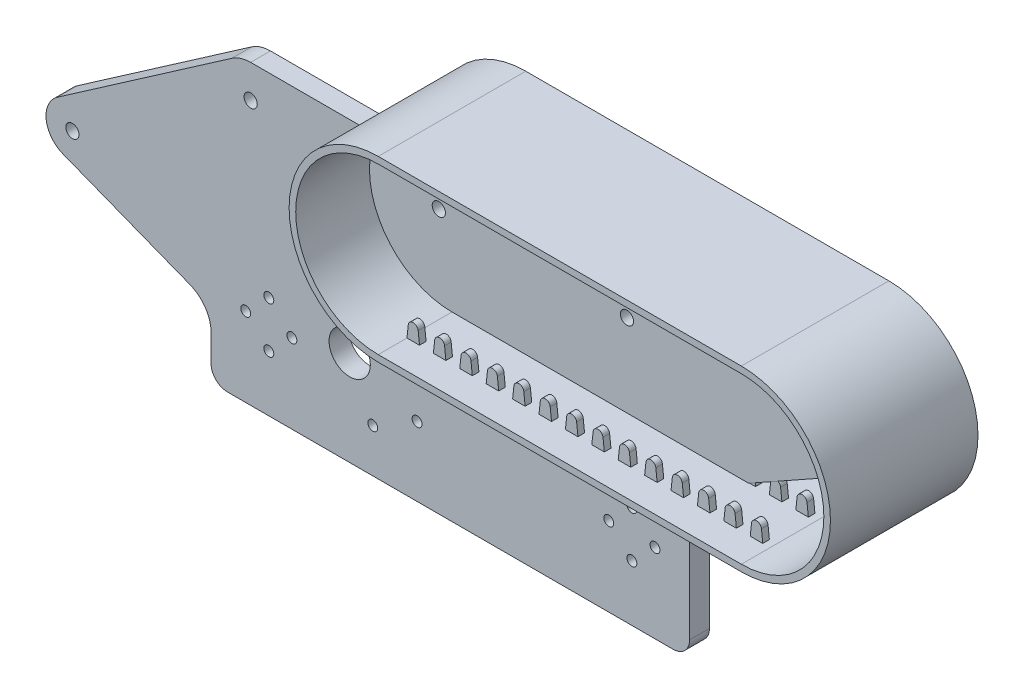
from build123d import *

# Parameters (mm, degrees)
SKETCH_1_R                        = 2
SKETCH_1_R_2                      = 6.25
SKETCH_1_R_3                      = 1.5
EXTRUDE_1_DEPTH                   = 6
SKETCH_2_R                        = 1.5
CUT_EXTRUDE_1_DEPTH               = 10
SKETCH_5_W                        = 44.7
SKETCH_5_H                        = 2
SKETCH_6_W                        = 3.8
SKETCH_6_H                        = 2
EXTRUDE_2_DEPTH                   = 10
CUT_EXTRUDE_2_DEPTH               = 19
PATTERN_LINEAR_2_COUNT            = 14
PATTERN_LINEAR_2_PITCH            = 8
PATTERN_LINEAR_2_COPY_1_SKETCH_W  = 3.8
PATTERN_LINEAR_2_COPY_1_SKETCH_H  = 2
PATTERN_LINEAR_2_COPY_1_DEPTH     = 10
PATTERN_LINEAR_2_COPY_2_SKETCH_W  = 3.8
PATTERN_LINEAR_2_COPY_2_SKETCH_H  = 2
PATTERN_LINEAR_2_COPY_2_DEPTH     = 10
PATTERN_LINEAR_2_COPY_3_SKETCH_W  = 3.8
PATTERN_LINEAR_2_COPY_3_SKETCH_H  = 2
PATTERN_LINEAR_2_COPY_3_DEPTH     = 10
PATTERN_LINEAR_2_COPY_4_SKETCH_W  = 3.8
PATTERN_LINEAR_2_COPY_4_SKETCH_H  = 2
PATTERN_LINEAR_2_COPY_4_DEPTH     = 10
PATTERN_LINEAR_2_COPY_5_SKETCH_W  = 3.8
PATTERN_LINEAR_2_COPY_5_SKETCH_H  = 2
PATTERN_LINEAR_2_COPY_5_DEPTH     = 10
PATTERN_LINEAR_2_COPY_6_SKETCH_W  = 3.8
PATTERN_LINEAR_2_COPY_6_SKETCH_H  = 2
PATTERN_LINEAR_2_COPY_6_DEPTH     = 10
PATTERN_LINEAR_2_COPY_7_SKETCH_W  = 3.8
PATTERN_LINEAR_2_COPY_7_SKETCH_H  = 2
PATTERN_LINEAR_2_COPY_7_DEPTH     = 10
PATTERN_LINEAR_2_COPY_8_SKETCH_W  = 3.8
PATTERN_LINEAR_2_COPY_8_SKETCH_H  = 2
PATTERN_LINEAR_2_COPY_8_DEPTH     = 10
PATTERN_LINEAR_2_COPY_9_SKETCH_W  = 3.8
PATTERN_LINEAR_2_COPY_9_SKETCH_H  = 2
PATTERN_LINEAR_2_COPY_9_DEPTH     = 10
PATTERN_LINEAR_2_COPY_10_SKETCH_W = 3.8
PATTERN_LINEAR_2_COPY_10_SKETCH_H = 2
PATTERN_LINEAR_2_COPY_10_DEPTH    = 10
PATTERN_LINEAR_2_COPY_11_SKETCH_W = 3.8
PATTERN_LINEAR_2_COPY_11_SKETCH_H = 2
PATTERN_LINEAR_2_COPY_11_DEPTH    = 10
PATTERN_LINEAR_2_COPY_12_SKETCH_W = 3.8
PATTERN_LINEAR_2_COPY_12_SKETCH_H = 2
PATTERN_LINEAR_2_COPY_12_DEPTH    = 10
PATTERN_LINEAR_2_COPY_13_SKETCH_W = 3.8
PATTERN_LINEAR_2_COPY_13_SKETCH_H = 2
PATTERN_LINEAR_2_COPY_13_DEPTH    = 10
PATTERN_LINEAR_2_COPY_14_DEPTH    = 19
PATTERN_LINEAR_2_COPY_15_DEPTH    = 19
PATTERN_LINEAR_2_COPY_16_DEPTH    = 19
PATTERN_LINEAR_2_COPY_17_DEPTH    = 19
PATTERN_LINEAR_2_COPY_18_DEPTH    = 19
PATTERN_LINEAR_2_COPY_19_DEPTH    = 19
PATTERN_LINEAR_2_COPY_20_DEPTH    = 19
PATTERN_LINEAR_2_COPY_21_DEPTH    = 19
PATTERN_LINEAR_2_COPY_22_DEPTH    = 19
PATTERN_LINEAR_2_COPY_23_DEPTH    = 19
PATTERN_LINEAR_2_COPY_24_DEPTH    = 19
PATTERN_LINEAR_2_COPY_25_DEPTH    = 19
PATTERN_LINEAR_2_COPY_26_DEPTH    = 19


with BuildPart() as part:
    # 草图1 → 凸台-拉伸1 (new body)
    with BuildSketch(Plane.XY):
        with BuildLine():
            Line((0, 5), (0, 13.171101822))
            ThreePointArc((0, 13.171101822), (-1.741847838, 18.810509847), (-6.360584575, 22.485319737))
            Line((-6.360584575, 22.485319737), (-44.91153234, 37.548625668))
            ThreePointArc((-44.91153234, 37.548625668), (-49.945464669, 44.067481265), (-46.557706877, 51.574747753))
            Line((-46.557706877, 51.574747753), (6.302866403, 88.218434692))
            ThreePointArc((6.302866403, 88.218434692), (9.015401779, 89.544221993), (12, 90))
            Line((12, 90), (187, 90))
            ThreePointArc((187, 90), (196.675632202, 82.526290066), (191.888690703, 71.2764283))
            Line((191.888690703, 71.2764283), (150.111309297, 47.864378387))
            ThreePointArc((150.111309297, 47.864378387), (146.371938021, 44.196154992), (145, 39.140806687))
            Line((145, 39.140806687), (145, 5))
            ThreePointArc((145, 5), (143.535533906, 1.464466094), (140, 0))
            Line((140, 0), (5, 0))
            ThreePointArc((5, 0), (1.464466094, 1.464466094), (0, 5))
        make_face()
        with Locations((-42, 45)):
            Circle(SKETCH_1_R, mode=Mode.SUBTRACT)
        with Locations((12, 80)):
            Circle(SKETCH_1_R, mode=Mode.SUBTRACT)
        with Locations((69, 80)):
            Circle(SKETCH_1_R, mode=Mode.SUBTRACT)
        with Locations((126, 80)):
            Circle(SKETCH_1_R, mode=Mode.SUBTRACT)
        with Locations((42, 28.75)):
            Circle(SKETCH_1_R_2, mode=Mode.SUBTRACT)
        with Locations((49, 44.25)):
            Circle(SKETCH_1_R_3, mode=Mode.SUBTRACT)
        with Locations((49, 13.25)):
            Circle(SKETCH_1_R_3, mode=Mode.SUBTRACT)
        with Locations((62.423393759, 21)):
            Circle(SKETCH_1_R_3, mode=Mode.SUBTRACT)
        with Locations((62.423393759, 36.5)):
            Circle(SKETCH_1_R_3, mode=Mode.SUBTRACT)
        with BuildLine():
            Line((183, 82), (187, 82))
            ThreePointArc((187, 82), (189, 80), (187, 78))
            Line((187, 78), (183, 78))
            ThreePointArc((183, 78), (181, 80), (183, 82))
        make_face(mode=Mode.SUBTRACT)
    extrude(amount=EXTRUDE_1_DEPTH)

    # 草图2 → 切除-拉伸1 (cut)
    with BuildSketch(Plane(origin=(0, 0, 0), x_dir=(-1, 0, 0), z_dir=(0, 0, -1))):
        with Locations((-17.5, 17)):
            Circle(SKETCH_2_R)
        with Locations((-24.5, 24)):
            Circle(SKETCH_2_R)
        with Locations((-17.5, 31)):
            Circle(SKETCH_2_R)
        with Locations((-10.5, 24)):
            Circle(SKETCH_2_R)
        with Locations((-127.5, 17)):
            Circle(SKETCH_2_R)
        with Locations((-134.5, 24)):
            Circle(SKETCH_2_R)
        with Locations((-127.5, 31)):
            Circle(SKETCH_2_R)
        with Locations((-120.5, 24)):
            Circle(SKETCH_2_R)
    extrude(amount=-CUT_EXTRUDE_1_DEPTH, mode=Mode.SUBTRACT)


with BuildPart() as body_2:
    # 扫描1: sweep along a path in 草图3
    with BuildLine(Plane.XY.offset(6)) as sweep_1_path:
        Line((73, 54), (183, 54))
        ThreePointArc((183, 54), (209, 80), (183, 106))
        Line((183, 106), (73, 106))
        ThreePointArc((73, 106), (47, 80), (73, 54))
    # 草图5 → 扫描1 (sweep)
    with BuildSketch(Plane(origin=(73, 54, 6), x_dir=(0, 0, -1), z_dir=(1, 0, 0))):
        Rectangle(SKETCH_5_W, SKETCH_5_H)
    sweep(path=sweep_1_path.line)

    # 草图6 → 凸台-拉伸2 (add)
    with BuildSketch(Plane(origin=(0, 55, 0), x_dir=(1, 0, 0), z_dir=(0, 1, 0))):
        with Locations((74.9, -4.85)):
            Rectangle(SKETCH_6_W, SKETCH_6_H)
        with Locations((74.9, -18.65)):
            Rectangle(SKETCH_6_W, SKETCH_6_H)
    extrude_2 = extrude(amount=EXTRUDE_2_DEPTH)

    # 草图7 → 切除-拉伸2 (cut)
    with BuildSketch(Plane.XY.offset(19.65)):
        with BuildLine():
            Line((73.4, 58.65519493), (73, 55))
            Line((73, 55), (73, 65))
            Line((73, 65), (76.8, 65))
            Line((76.8, 65), (76.8, 55))
            Line((76.8, 55), (76.4, 58.65519493))
            ThreePointArc((76.4, 58.65519493), (74.9, 60), (73.4, 58.65519493))
        make_face()
    cut_extrude_2 = extrude(amount=-CUT_EXTRUDE_2_DEPTH, mode=Mode.SUBTRACT)

    # 镜向1: 凸台-拉伸2, 切除-拉伸2 across plane
    add(extrude_2.mirror(Plane.ZX.offset(80)))
    add(cut_extrude_2.mirror(Plane.ZX.offset(80)), mode=Mode.SUBTRACT)

    # 阵列(线性)2: 凸台-拉伸2, 切除-拉伸2 ×14
    with Locations(*[(i * PATTERN_LINEAR_2_PITCH, 0, 0) for i in range(1, PATTERN_LINEAR_2_COUNT)]):
        add(extrude_2)
        add(cut_extrude_2, mode=Mode.SUBTRACT)

    # 阵列(线性)2 copy 1 sketch → 阵列(线性)2 copy 1 (add)
    with BuildSketch(Plane(origin=(8, 105, 0), x_dir=(1, 0, 0), z_dir=(0, -1, 0))):
        with Locations((74.9, 4.85)):
            Rectangle(PATTERN_LINEAR_2_COPY_1_SKETCH_W, PATTERN_LINEAR_2_COPY_1_SKETCH_H)
        with Locations((74.9, 18.65)):
            Rectangle(PATTERN_LINEAR_2_COPY_1_SKETCH_W, PATTERN_LINEAR_2_COPY_1_SKETCH_H)
    extrude(amount=PATTERN_LINEAR_2_COPY_1_DEPTH)

    # 阵列(线性)2 copy 2 sketch → 阵列(线性)2 copy 2 (add)
    with BuildSketch(Plane(origin=(16, 105, 0), x_dir=(1, 0, 0), z_dir=(0, -1, 0))):
        with Locations((74.9, 4.85)):
            Rectangle(PATTERN_LINEAR_2_COPY_2_SKETCH_W, PATTERN_LINEAR_2_COPY_2_SKETCH_H)
        with Locations((74.9, 18.65)):
            Rectangle(PATTERN_LINEAR_2_COPY_2_SKETCH_W, PATTERN_LINEAR_2_COPY_2_SKETCH_H)
    extrude(amount=PATTERN_LINEAR_2_COPY_2_DEPTH)

    # 阵列(线性)2 copy 3 sketch → 阵列(线性)2 copy 3 (add)
    with BuildSketch(Plane(origin=(24, 105, 0), x_dir=(1, 0, 0), z_dir=(0, -1, 0))):
        with Locations((74.9, 4.85)):
            Rectangle(PATTERN_LINEAR_2_COPY_3_SKETCH_W, PATTERN_LINEAR_2_COPY_3_SKETCH_H)
        with Locations((74.9, 18.65)):
            Rectangle(PATTERN_LINEAR_2_COPY_3_SKETCH_W, PATTERN_LINEAR_2_COPY_3_SKETCH_H)
    extrude(amount=PATTERN_LINEAR_2_COPY_3_DEPTH)

    # 阵列(线性)2 copy 4 sketch → 阵列(线性)2 copy 4 (add)
    with BuildSketch(Plane(origin=(32, 105, 0), x_dir=(1, 0, 0), z_dir=(0, -1, 0))):
        with Locations((74.9, 4.85)):
            Rectangle(PATTERN_LINEAR_2_COPY_4_SKETCH_W, PATTERN_LINEAR_2_COPY_4_SKETCH_H)
        with Locations((74.9, 18.65)):
            Rectangle(PATTERN_LINEAR_2_COPY_4_SKETCH_W, PATTERN_LINEAR_2_COPY_4_SKETCH_H)
    extrude(amount=PATTERN_LINEAR_2_COPY_4_DEPTH)

    # 阵列(线性)2 copy 5 sketch → 阵列(线性)2 copy 5 (add)
    with BuildSketch(Plane(origin=(40, 105, 0), x_dir=(1, 0, 0), z_dir=(0, -1, 0))):
        with Locations((74.9, 4.85)):
            Rectangle(PATTERN_LINEAR_2_COPY_5_SKETCH_W, PATTERN_LINEAR_2_COPY_5_SKETCH_H)
        with Locations((74.9, 18.65)):
            Rectangle(PATTERN_LINEAR_2_COPY_5_SKETCH_W, PATTERN_LINEAR_2_COPY_5_SKETCH_H)
    extrude(amount=PATTERN_LINEAR_2_COPY_5_DEPTH)

    # 阵列(线性)2 copy 6 sketch → 阵列(线性)2 copy 6 (add)
    with BuildSketch(Plane(origin=(48, 105, 0), x_dir=(1, 0, 0), z_dir=(0, -1, 0))):
        with Locations((74.9, 4.85)):
            Rectangle(PATTERN_LINEAR_2_COPY_6_SKETCH_W, PATTERN_LINEAR_2_COPY_6_SKETCH_H)
        with Locations((74.9, 18.65)):
            Rectangle(PATTERN_LINEAR_2_COPY_6_SKETCH_W, PATTERN_LINEAR_2_COPY_6_SKETCH_H)
    extrude(amount=PATTERN_LINEAR_2_COPY_6_DEPTH)

    # 阵列(线性)2 copy 7 sketch → 阵列(线性)2 copy 7 (add)
    with BuildSketch(Plane(origin=(56, 105, 0), x_dir=(1, 0, 0), z_dir=(0, -1, 0))):
        with Locations((74.9, 4.85)):
            Rectangle(PATTERN_LINEAR_2_COPY_7_SKETCH_W, PATTERN_LINEAR_2_COPY_7_SKETCH_H)
        with Locations((74.9, 18.65)):
            Rectangle(PATTERN_LINEAR_2_COPY_7_SKETCH_W, PATTERN_LINEAR_2_COPY_7_SKETCH_H)
    extrude(amount=PATTERN_LINEAR_2_COPY_7_DEPTH)

    # 阵列(线性)2 copy 8 sketch → 阵列(线性)2 copy 8 (add)
    with BuildSketch(Plane(origin=(64, 105, 0), x_dir=(1, 0, 0), z_dir=(0, -1, 0))):
        with Locations((74.9, 4.85)):
            Rectangle(PATTERN_LINEAR_2_COPY_8_SKETCH_W, PATTERN_LINEAR_2_COPY_8_SKETCH_H)
        with Locations((74.9, 18.65)):
            Rectangle(PATTERN_LINEAR_2_COPY_8_SKETCH_W, PATTERN_LINEAR_2_COPY_8_SKETCH_H)
    extrude(amount=PATTERN_LINEAR_2_COPY_8_DEPTH)

    # 阵列(线性)2 copy 9 sketch → 阵列(线性)2 copy 9 (add)
    with BuildSketch(Plane(origin=(72, 105, 0), x_dir=(1, 0, 0), z_dir=(0, -1, 0))):
        with Locations((74.9, 4.85)):
            Rectangle(PATTERN_LINEAR_2_COPY_9_SKETCH_W, PATTERN_LINEAR_2_COPY_9_SKETCH_H)
        with Locations((74.9, 18.65)):
            Rectangle(PATTERN_LINEAR_2_COPY_9_SKETCH_W, PATTERN_LINEAR_2_COPY_9_SKETCH_H)
    extrude(amount=PATTERN_LINEAR_2_COPY_9_DEPTH)

    # 阵列(线性)2 copy 10 sketch → 阵列(线性)2 copy 10 (add)
    with BuildSketch(Plane(origin=(80, 105, 0), x_dir=(1, 0, 0), z_dir=(0, -1, 0))):
        with Locations((74.9, 4.85)):
            Rectangle(PATTERN_LINEAR_2_COPY_10_SKETCH_W, PATTERN_LINEAR_2_COPY_10_SKETCH_H)
        with Locations((74.9, 18.65)):
            Rectangle(PATTERN_LINEAR_2_COPY_10_SKETCH_W, PATTERN_LINEAR_2_COPY_10_SKETCH_H)
    extrude(amount=PATTERN_LINEAR_2_COPY_10_DEPTH)

    # 阵列(线性)2 copy 11 sketch → 阵列(线性)2 copy 11 (add)
    with BuildSketch(Plane(origin=(88, 105, 0), x_dir=(1, 0, 0), z_dir=(0, -1, 0))):
        with Locations((74.9, 4.85)):
            Rectangle(PATTERN_LINEAR_2_COPY_11_SKETCH_W, PATTERN_LINEAR_2_COPY_11_SKETCH_H)
        with Locations((74.9, 18.65)):
            Rectangle(PATTERN_LINEAR_2_COPY_11_SKETCH_W, PATTERN_LINEAR_2_COPY_11_SKETCH_H)
    extrude(amount=PATTERN_LINEAR_2_COPY_11_DEPTH)

    # 阵列(线性)2 copy 12 sketch → 阵列(线性)2 copy 12 (add)
    with BuildSketch(Plane(origin=(96, 105, 0), x_dir=(1, 0, 0), z_dir=(0, -1, 0))):
        with Locations((74.9, 4.85)):
            Rectangle(PATTERN_LINEAR_2_COPY_12_SKETCH_W, PATTERN_LINEAR_2_COPY_12_SKETCH_H)
        with Locations((74.9, 18.65)):
            Rectangle(PATTERN_LINEAR_2_COPY_12_SKETCH_W, PATTERN_LINEAR_2_COPY_12_SKETCH_H)
    extrude(amount=PATTERN_LINEAR_2_COPY_12_DEPTH)

    # 阵列(线性)2 copy 13 sketch → 阵列(线性)2 copy 13 (add)
    with BuildSketch(Plane(origin=(104, 105, 0), x_dir=(1, 0, 0), z_dir=(0, -1, 0))):
        with Locations((74.9, 4.85)):
            Rectangle(PATTERN_LINEAR_2_COPY_13_SKETCH_W, PATTERN_LINEAR_2_COPY_13_SKETCH_H)
        with Locations((74.9, 18.65)):
            Rectangle(PATTERN_LINEAR_2_COPY_13_SKETCH_W, PATTERN_LINEAR_2_COPY_13_SKETCH_H)
    extrude(amount=PATTERN_LINEAR_2_COPY_13_DEPTH)

    # 阵列(线性)2 copy 14 sketch → 阵列(线性)2 copy 14 (cut)
    with BuildSketch(Plane(origin=(8, 160, 19.65), x_dir=(1, 0, 0), z_dir=(0, 0, 1))):
        with BuildLine():
            Line((73.4, -58.65519493), (73, -55))
            Line((73, -55), (73, -65))
            Line((73, -65), (76.8, -65))
            Line((76.8, -65), (76.8, -55))
            Line((76.8, -55), (76.4, -58.65519493))
            ThreePointArc((76.4, -58.65519493), (74.9, -60), (73.4, -58.65519493))
        make_face()
    extrude(amount=-PATTERN_LINEAR_2_COPY_14_DEPTH, mode=Mode.SUBTRACT)

    # 阵列(线性)2 copy 15 sketch → 阵列(线性)2 copy 15 (cut)
    with BuildSketch(Plane(origin=(16, 160, 19.65), x_dir=(1, 0, 0), z_dir=(0, 0, 1))):
        with BuildLine():
            Line((73.4, -58.65519493), (73, -55))
            Line((73, -55), (73, -65))
            Line((73, -65), (76.8, -65))
            Line((76.8, -65), (76.8, -55))
            Line((76.8, -55), (76.4, -58.65519493))
            ThreePointArc((76.4, -58.65519493), (74.9, -60), (73.4, -58.65519493))
        make_face()
    extrude(amount=-PATTERN_LINEAR_2_COPY_15_DEPTH, mode=Mode.SUBTRACT)

    # 阵列(线性)2 copy 16 sketch → 阵列(线性)2 copy 16 (cut)
    with BuildSketch(Plane(origin=(24, 160, 19.65), x_dir=(1, 0, 0), z_dir=(0, 0, 1))):
        with BuildLine():
            Line((73.4, -58.65519493), (73, -55))
            Line((73, -55), (73, -65))
            Line((73, -65), (76.8, -65))
            Line((76.8, -65), (76.8, -55))
            Line((76.8, -55), (76.4, -58.65519493))
            ThreePointArc((76.4, -58.65519493), (74.9, -60), (73.4, -58.65519493))
        make_face()
    extrude(amount=-PATTERN_LINEAR_2_COPY_16_DEPTH, mode=Mode.SUBTRACT)

    # 阵列(线性)2 copy 17 sketch → 阵列(线性)2 copy 17 (cut)
    with BuildSketch(Plane(origin=(32, 160, 19.65), x_dir=(1, 0, 0), z_dir=(0, 0, 1))):
        with BuildLine():
            Line((73.4, -58.65519493), (73, -55))
            Line((73, -55), (73, -65))
            Line((73, -65), (76.8, -65))
            Line((76.8, -65), (76.8, -55))
            Line((76.8, -55), (76.4, -58.65519493))
            ThreePointArc((76.4, -58.65519493), (74.9, -60), (73.4, -58.65519493))
        make_face()
    extrude(amount=-PATTERN_LINEAR_2_COPY_17_DEPTH, mode=Mode.SUBTRACT)

    # 阵列(线性)2 copy 18 sketch → 阵列(线性)2 copy 18 (cut)
    with BuildSketch(Plane(origin=(40, 160, 19.65), x_dir=(1, 0, 0), z_dir=(0, 0, 1))):
        with BuildLine():
            Line((73.4, -58.65519493), (73, -55))
            Line((73, -55), (73, -65))
            Line((73, -65), (76.8, -65))
            Line((76.8, -65), (76.8, -55))
            Line((76.8, -55), (76.4, -58.65519493))
            ThreePointArc((76.4, -58.65519493), (74.9, -60), (73.4, -58.65519493))
        make_face()
    extrude(amount=-PATTERN_LINEAR_2_COPY_18_DEPTH, mode=Mode.SUBTRACT)

    # 阵列(线性)2 copy 19 sketch → 阵列(线性)2 copy 19 (cut)
    with BuildSketch(Plane(origin=(48, 160, 19.65), x_dir=(1, 0, 0), z_dir=(0, 0, 1))):
        with BuildLine():
            Line((73.4, -58.65519493), (73, -55))
            Line((73, -55), (73, -65))
            Line((73, -65), (76.8, -65))
            Line((76.8, -65), (76.8, -55))
            Line((76.8, -55), (76.4, -58.65519493))
            ThreePointArc((76.4, -58.65519493), (74.9, -60), (73.4, -58.65519493))
        make_face()
    extrude(amount=-PATTERN_LINEAR_2_COPY_19_DEPTH, mode=Mode.SUBTRACT)

    # 阵列(线性)2 copy 20 sketch → 阵列(线性)2 copy 20 (cut)
    with BuildSketch(Plane(origin=(56, 160, 19.65), x_dir=(1, 0, 0), z_dir=(0, 0, 1))):
        with BuildLine():
            Line((73.4, -58.65519493), (73, -55))
            Line((73, -55), (73, -65))
            Line((73, -65), (76.8, -65))
            Line((76.8, -65), (76.8, -55))
            Line((76.8, -55), (76.4, -58.65519493))
            ThreePointArc((76.4, -58.65519493), (74.9, -60), (73.4, -58.65519493))
        make_face()
    extrude(amount=-PATTERN_LINEAR_2_COPY_20_DEPTH, mode=Mode.SUBTRACT)

    # 阵列(线性)2 copy 21 sketch → 阵列(线性)2 copy 21 (cut)
    with BuildSketch(Plane(origin=(64, 160, 19.65), x_dir=(1, 0, 0), z_dir=(0, 0, 1))):
        with BuildLine():
            Line((73.4, -58.65519493), (73, -55))
            Line((73, -55), (73, -65))
            Line((73, -65), (76.8, -65))
            Line((76.8, -65), (76.8, -55))
            Line((76.8, -55), (76.4, -58.65519493))
            ThreePointArc((76.4, -58.65519493), (74.9, -60), (73.4, -58.65519493))
        make_face()
    extrude(amount=-PATTERN_LINEAR_2_COPY_21_DEPTH, mode=Mode.SUBTRACT)

    # 阵列(线性)2 copy 22 sketch → 阵列(线性)2 copy 22 (cut)
    with BuildSketch(Plane(origin=(72, 160, 19.65), x_dir=(1, 0, 0), z_dir=(0, 0, 1))):
        with BuildLine():
            Line((73.4, -58.65519493), (73, -55))
            Line((73, -55), (73, -65))
            Line((73, -65), (76.8, -65))
            Line((76.8, -65), (76.8, -55))
            Line((76.8, -55), (76.4, -58.65519493))
            ThreePointArc((76.4, -58.65519493), (74.9, -60), (73.4, -58.65519493))
        make_face()
    extrude(amount=-PATTERN_LINEAR_2_COPY_22_DEPTH, mode=Mode.SUBTRACT)

    # 阵列(线性)2 copy 23 sketch → 阵列(线性)2 copy 23 (cut)
    with BuildSketch(Plane(origin=(80, 160, 19.65), x_dir=(1, 0, 0), z_dir=(0, 0, 1))):
        with BuildLine():
            Line((73.4, -58.65519493), (73, -55))
            Line((73, -55), (73, -65))
            Line((73, -65), (76.8, -65))
            Line((76.8, -65), (76.8, -55))
            Line((76.8, -55), (76.4, -58.65519493))
            ThreePointArc((76.4, -58.65519493), (74.9, -60), (73.4, -58.65519493))
        make_face()
    extrude(amount=-PATTERN_LINEAR_2_COPY_23_DEPTH, mode=Mode.SUBTRACT)

    # 阵列(线性)2 copy 24 sketch → 阵列(线性)2 copy 24 (cut)
    with BuildSketch(Plane(origin=(88, 160, 19.65), x_dir=(1, 0, 0), z_dir=(0, 0, 1))):
        with BuildLine():
            Line((73.4, -58.65519493), (73, -55))
            Line((73, -55), (73, -65))
            Line((73, -65), (76.8, -65))
            Line((76.8, -65), (76.8, -55))
            Line((76.8, -55), (76.4, -58.65519493))
            ThreePointArc((76.4, -58.65519493), (74.9, -60), (73.4, -58.65519493))
        make_face()
    extrude(amount=-PATTERN_LINEAR_2_COPY_24_DEPTH, mode=Mode.SUBTRACT)

    # 阵列(线性)2 copy 25 sketch → 阵列(线性)2 copy 25 (cut)
    with BuildSketch(Plane(origin=(96, 160, 19.65), x_dir=(1, 0, 0), z_dir=(0, 0, 1))):
        with BuildLine():
            Line((73.4, -58.65519493), (73, -55))
            Line((73, -55), (73, -65))
            Line((73, -65), (76.8, -65))
            Line((76.8, -65), (76.8, -55))
            Line((76.8, -55), (76.4, -58.65519493))
            ThreePointArc((76.4, -58.65519493), (74.9, -60), (73.4, -58.65519493))
        make_face()
    extrude(amount=-PATTERN_LINEAR_2_COPY_25_DEPTH, mode=Mode.SUBTRACT)

    # 阵列(线性)2 copy 26 sketch → 阵列(线性)2 copy 26 (cut)
    with BuildSketch(Plane(origin=(104, 160, 19.65), x_dir=(1, 0, 0), z_dir=(0, 0, 1))):
        with BuildLine():
            Line((73.4, -58.65519493), (73, -55))
            Line((73, -55), (73, -65))
            Line((73, -65), (76.8, -65))
            Line((76.8, -65), (76.8, -55))
            Line((76.8, -55), (76.4, -58.65519493))
            ThreePointArc((76.4, -58.65519493), (74.9, -60), (73.4, -58.65519493))
        make_face()
    extrude(amount=-PATTERN_LINEAR_2_COPY_26_DEPTH, mode=Mode.SUBTRACT)


solid = Compound([part.part, body_2.part])
